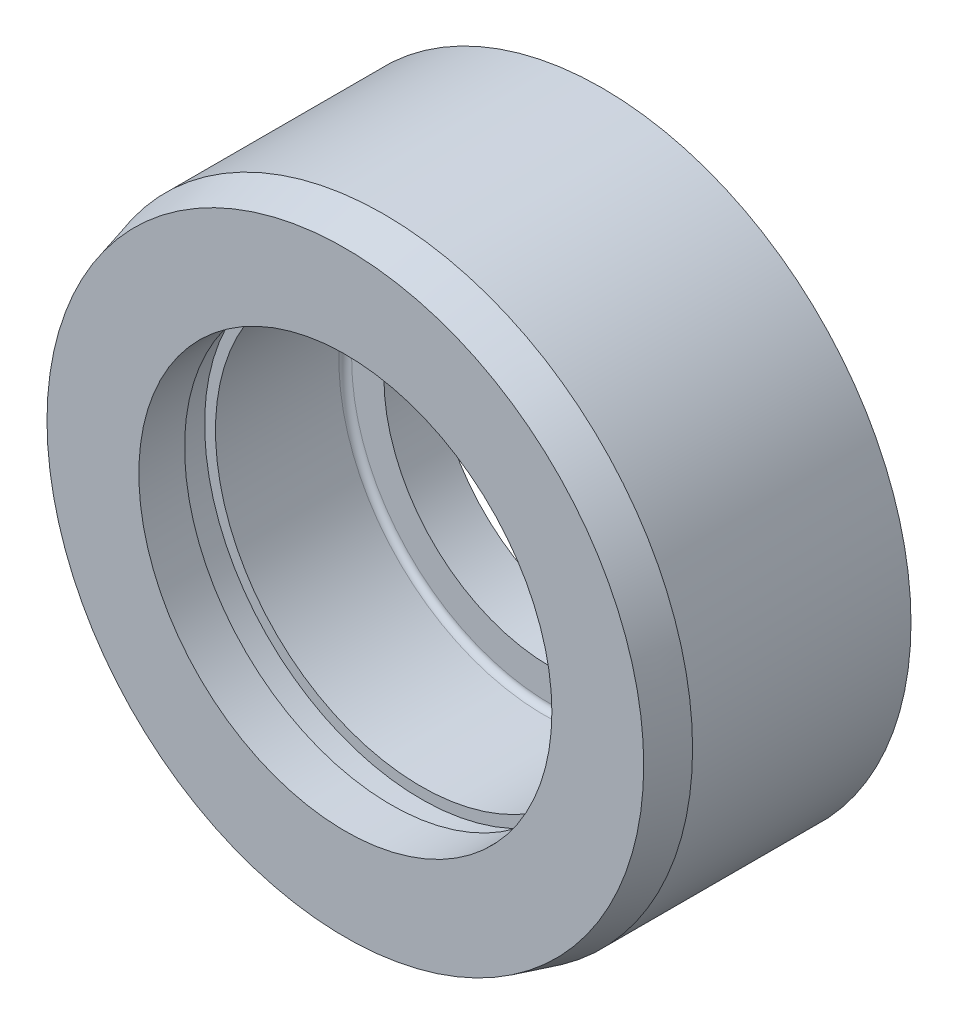
from build123d import *

# Parameters (mm, degrees)
SKETCH1_R      = 12.0135
EXTRUDE1_DEPTH = 10
SKETCH3_R      = 8.0045
EXTRUDE2_DEPTH = 8
SKETCH4_R      = 6.5
EXTRUDE3_DEPTH = 19.778934062
FILLET1_R      = 0.25
EXTRUDE4_START = -1.78
SKETCH5_R      = 8.4275
EXTRUDE4_DEPTH = 1.17
EXTRUDE5_REACH = 21.714
SKETCH6_R      = 8.0375
CHAMFER2_SIZE  = 1.5
CHAMFER2_SIZE2 = 0.401923789


with BuildPart() as part:
    # Sketch1 → Extrude1 (new body)
    with BuildSketch(Plane.XY):
        Circle(SKETCH1_R)
    extrude(amount=EXTRUDE1_DEPTH)

    # Sketch3 → Extrude2 (cut)
    with BuildSketch(Plane.XY.offset(10)):
        Circle(SKETCH3_R)
    extrude(amount=-EXTRUDE2_DEPTH, mode=Mode.SUBTRACT)

    # Sketch4 → Extrude3 (cut, through all)
    with BuildSketch(Plane.XY.offset(2)):
        Circle(SKETCH4_R)
    extrude(amount=-EXTRUDE3_DEPTH, mode=Mode.SUBTRACT)

    # Fillet1
    fillet1_edges = [part.edges().sort_by_distance(p)[0] for p in [
        (-8.0045, 0, 2),
    ]]
    fillet(fillet1_edges, radius=FILLET1_R)

    # Sketch5 → Extrude4 (cut)
    with BuildSketch(Plane.XY.offset(10).offset(EXTRUDE4_START)):
        Circle(SKETCH5_R)
    extrude(amount=-EXTRUDE4_DEPTH, mode=Mode.SUBTRACT)

    # Sketch6 → Extrude5 (cut, up to next)
    with BuildSketch(Plane.XY.offset(10), mode=Mode.PRIVATE) as extrude5_sk1:
        Circle(SKETCH6_R)
    extrude5_tool1 = extrude(extrude5_sk1.sketch, amount=-EXTRUDE5_REACH, mode=Mode.PRIVATE) & part.part
    add(extrude5_tool1.solids().sort_by_distance((0, 0, 10))[0], mode=Mode.SUBTRACT)

    # Chamfer2
    chamfer2_edges = [part.edges().sort_by_distance(p)[0] for p in [
        (-12.0135, 0, 10),
    ]]
    chamfer2_side = [part.faces().sort_by_distance(p)[0] for p in [
        (-12.0135, 0, 5),
    ]]
    chamfer(chamfer2_edges, length=CHAMFER2_SIZE, length2=CHAMFER2_SIZE2, reference=chamfer2_side[0])


solid = part.part
